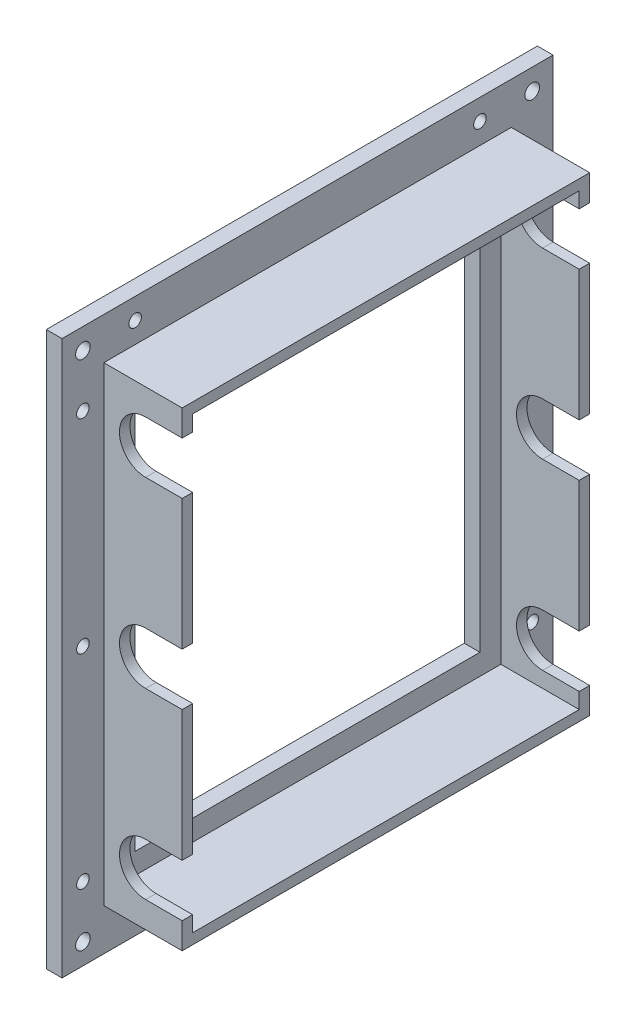
from build123d import *

# Parameters (mm, degrees)
SKETCH_1_W          = 470
SKETCH_1_H          = 530
SKETCH_1_R          = 7
SKETCH_1_R_2        = 6
SKETCH_1_W_2        = 330
SKETCH_1_H_2        = 390
EXTRUDE_1_DEPTH     = 15
SKETCH_2_W          = 390
SKETCH_2_H          = 450
SKETCH_2_W_2        = 370
SKETCH_2_H_2        = 430
EXTRUDE_2_DEPTH     = 75
CUT_EXTRUDE_1_DEPTH = 514.054577993


with BuildPart() as part:
    # 草图1 → 凸台-拉伸1 (new body)
    with BuildSketch(Plane(origin=(0, 0, 0), x_dir=(0, 0, -1), z_dir=(1, 0, 0))):
        Rectangle(SKETCH_1_W, SKETCH_1_H)
        with Locations((-215, 245)):
            Circle(SKETCH_1_R, mode=Mode.SUBTRACT)
        with Locations((-165, 245)):
            Circle(SKETCH_1_R_2, mode=Mode.SUBTRACT)
        with Locations((-215, 195)):
            Circle(SKETCH_1_R_2, mode=Mode.SUBTRACT)
        with Locations(Location((215, 245, 0), (0, 0, 180))):
            Circle(SKETCH_1_R, mode=Mode.SUBTRACT)
        with Locations(Location((165, 245, 0), (0, 0, 180))):
            Circle(SKETCH_1_R_2, mode=Mode.SUBTRACT)
        with Locations(Location((215, 195, 0), (0, 0, 180))):
            Circle(SKETCH_1_R_2, mode=Mode.SUBTRACT)
        with Locations(Location((-215, -195, 0), (0, 0, 180))):
            Circle(SKETCH_1_R_2, mode=Mode.SUBTRACT)
        with Locations(Location((-165, -245, 0), (0, 0, 180))):
            Circle(SKETCH_1_R_2, mode=Mode.SUBTRACT)
        with Locations(Location((-215, -245, 0), (0, 0, 180))):
            Circle(SKETCH_1_R, mode=Mode.SUBTRACT)
        with Locations((165, -245)):
            Circle(SKETCH_1_R_2, mode=Mode.SUBTRACT)
        with Locations((215, -245)):
            Circle(SKETCH_1_R, mode=Mode.SUBTRACT)
        with Locations((215, -195)):
            Circle(SKETCH_1_R_2, mode=Mode.SUBTRACT)
        with Locations((-215, 0)):
            Circle(SKETCH_1_R_2, mode=Mode.SUBTRACT)
        with Locations(Location((215, 0, 0), (0, 0, 180))):
            Circle(SKETCH_1_R_2, mode=Mode.SUBTRACT)
        Rectangle(SKETCH_1_W_2, SKETCH_1_H_2, mode=Mode.SUBTRACT)
    extrude(amount=EXTRUDE_1_DEPTH)

    # 草图2 → 凸台-拉伸2 (add)
    with BuildSketch(Plane(origin=(15, 0, 0), x_dir=(0, 0, -1), z_dir=(1, 0, 0))):
        Rectangle(SKETCH_2_W, SKETCH_2_H)
        Rectangle(SKETCH_2_W_2, SKETCH_2_H_2, mode=Mode.SUBTRACT)
    extrude(amount=EXTRUDE_2_DEPTH)

    # 草图4 → 切除-拉伸1 (cut, through all)
    with BuildSketch(Plane.XY.offset(195)):
        with BuildLine():
            Line((90, 25), (55, 25))
            ThreePointArc((55, 25), (30, 0), (55, -25))
            Line((55, -25), (90, -25))
            Line((90, -25), (90, 25))
        make_face()
        with BuildLine():
            Line((90, 200), (55, 200))
            ThreePointArc((55, 200), (30, 175), (55, 150))
            Line((55, 150), (90, 150))
            Line((90, 150), (90, 200))
        make_face()
        with BuildLine():
            Line((90, -150), (90, -200))
            Line((90, -200), (55, -200))
            ThreePointArc((55, -200), (30, -175), (55, -150))
            Line((55, -150), (90, -150))
        make_face()
    extrude(amount=-CUT_EXTRUDE_1_DEPTH, mode=Mode.SUBTRACT)


solid = part.part
